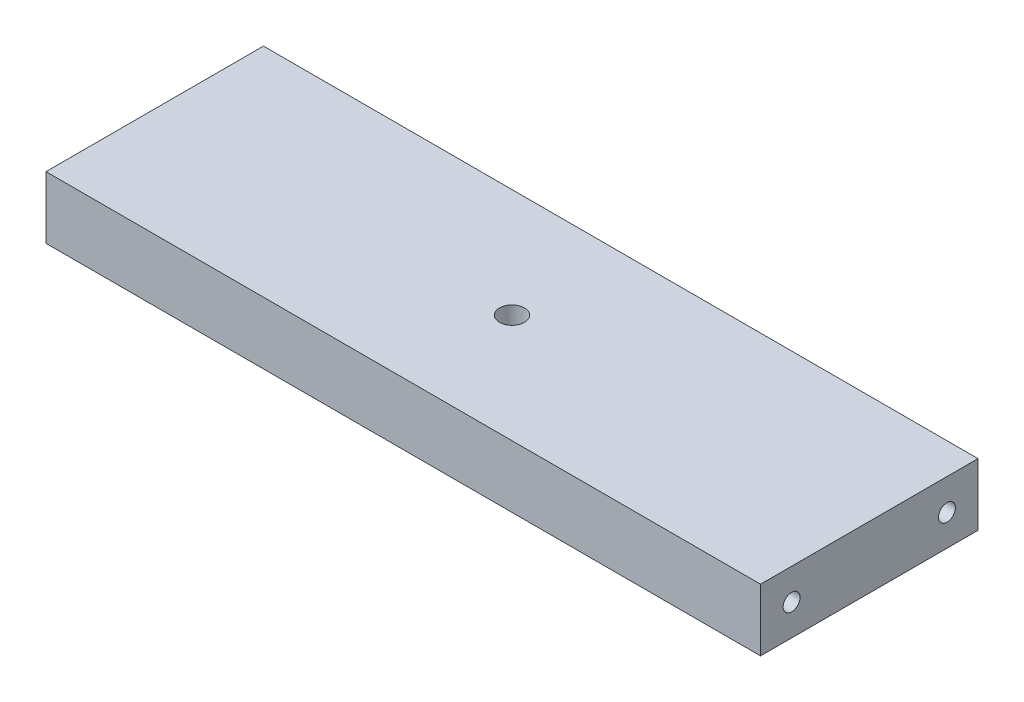
from build123d import *

# Parameters (mm, degrees)
SKETCH2_W                      = 146.05
SKETCH2_H                      = 44.45
BOSS_EXTRUDE1_DEPTH            = 12.7
F_1_4_20_TAPPED_HOLE1_D        = 5.1054
F_8_32_TAPPED_HOLE1_AT_2_COUNT = 2
F_8_32_TAPPED_HOLE1_AT_2_PITCH = 31.75


with BuildPart() as part:
    # Sketch2 → Boss-Extrude1 (new body)
    with BuildSketch(Plane(origin=(0, 0, 0), x_dir=(1, 0, 0), z_dir=(0, 1, 0))):
        Rectangle(SKETCH2_W, SKETCH2_H)
    extrude(amount=BOSS_EXTRUDE1_DEPTH)

    # 1/4-20 Tapped Hole1 (through all)
    with Locations(Plane(origin=(0, 0, 0), x_dir=(-1, 0, 0), z_dir=(0, -1, 0))):
        with Locations((0, 0)):
            Hole(F_1_4_20_TAPPED_HOLE1_D / 2)

    # Sketch7 → #8-32 Tapped Hole1 (revolve, cut)
    with BuildSketch(Plane(origin=(-73.025, 6.35, -15.875), x_dir=(0, 0, 1), z_dir=(0, 1, 0))):
        Polygon((0, 0), (0, 7.387806461), (1.7272, 6.35), (1.7272, 0), align=None)
    f_8_32_tapped_hole1 = revolve(axis=Axis((-79.375, 6.35, -15.875), (1, 0, 0)), mode=Mode.SUBTRACT)

    # #8-32 Tapped Hole1 at 2: #8-32 Tapped Hole1 ×2
    with Locations(*[(0, 0, i * F_8_32_TAPPED_HOLE1_AT_2_PITCH) for i in range(1, F_8_32_TAPPED_HOLE1_AT_2_COUNT)]):
        add(f_8_32_tapped_hole1, mode=Mode.SUBTRACT)

    # Mirror1: #8-32 Tapped Hole1 across plane
    add(f_8_32_tapped_hole1.mirror(Plane(origin=(0, 0, 0), x_dir=(0, 0, 1), z_dir=(1, 0, 0))), mode=Mode.SUBTRACT)

    # Mirror1 copy 1 sketch → Mirror1 copy 1 (revolve, cut)
    with BuildSketch(Plane(origin=(73.025, 6.35, 15.875), x_dir=(0, 0, 1), z_dir=(0, 1, 0))):
        Polygon((0, 0), (0, -7.387806461), (1.7272, -6.35), (1.7272, 0), align=None)
    revolve(axis=Axis((79.375, 6.35, 15.875), (1, 0, 0)), mode=Mode.SUBTRACT)


solid = part.part
